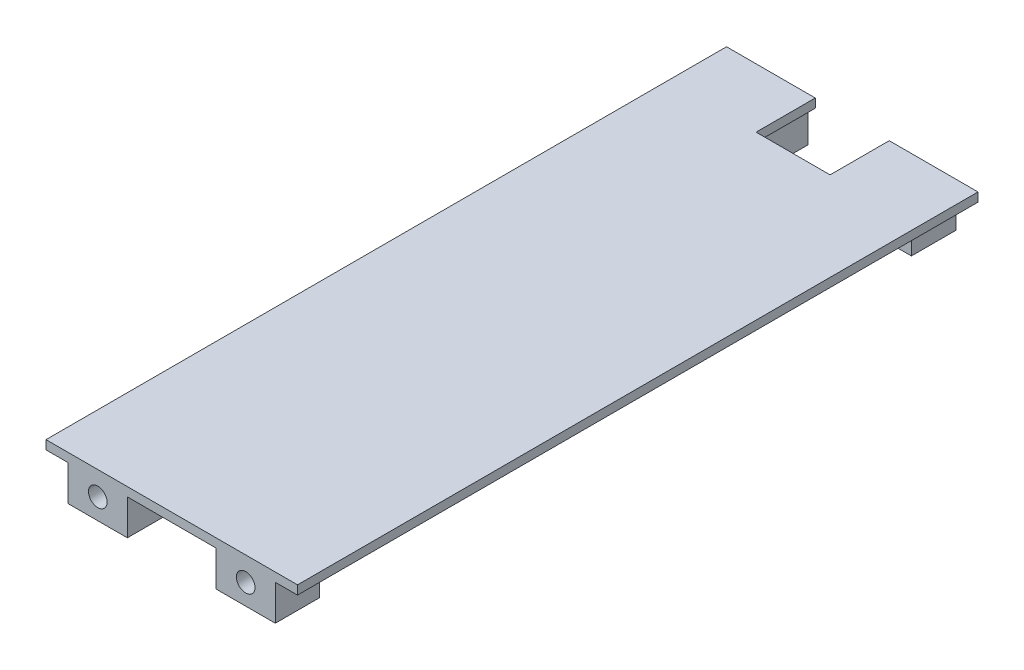
from build123d import *

# Parameters (mm, degrees)
SKETCH1_W           = 20
SKETCH1_H           = 12
SKETCH1_R           = 3.15
SKETCH1_W_2         = 85
SKETCH1_H_2         = 3
BOSS_EXTRUDE1_DEPTH = 230
SKETCH2_W           = 200
SKETCH2_H           = 15
CUT_EXTRUDE1_DEPTH  = 210
SKETCH3_W           = 43.6
SKETCH3_H           = 137.6
SKETCH3_W_2         = 37
SKETCH3_H_2         = 131
BOSS_EXTRUDE2_DEPTH = 12
CUT_EXTRUDE2_DEPTH  = 199.566588327
SKETCH6_R           = 2.5
CUT_EXTRUDE3_DEPTH  = 150
SKETCH7_W           = 25
SKETCH7_H           = 40
CUT_EXTRUDE4_DEPTH  = 150


with BuildPart() as part:
    # Sketch1 → Boss-Extrude1 (new body)
    # profile 1 of 3: a face of its own
    with BuildSketch(Plane.XY):
        with Locations((-25, -1)):
            Rectangle(SKETCH1_W, SKETCH1_H)
        with Locations((-25, 0)):
            Circle(SKETCH1_R, mode=Mode.SUBTRACT)
    # profile 2 of 3: a face of its own
    with BuildSketch(Plane.XY):
        with Locations((25, -1)):
            Rectangle(SKETCH1_W, SKETCH1_H)
        with Locations((25, 0)):
            Circle(SKETCH1_R, mode=Mode.SUBTRACT)
    # profile 3 of 3: a face of its own
    with BuildSketch(Plane.XY):
        with Locations((0, 6.5)):
            Rectangle(SKETCH1_W_2, SKETCH1_H_2)
    extrude(amount=BOSS_EXTRUDE1_DEPTH)

    # Sketch2 → Cut-Extrude1 (cut)
    with BuildSketch(Plane.ZY.offset(35)):
        with Locations((115, -2.5)):
            Rectangle(SKETCH2_W, SKETCH2_H)
    extrude(amount=-CUT_EXTRUDE1_DEPTH, mode=Mode.SUBTRACT)

    # Sketch3 → Boss-Extrude2 (add)
    with BuildSketch(Plane.XZ.offset(-5)):
        with Locations((0, 105)):
            Rectangle(SKETCH3_W, SKETCH3_H)
        with Locations((0, 105)):
            Rectangle(SKETCH3_W_2, SKETCH3_H_2, mode=Mode.SUBTRACT)
    extrude(amount=BOSS_EXTRUDE2_DEPTH)

    # Sketch4 → Cut-Extrude2 (cut, through all)
    with BuildSketch(Plane(origin=(0, 0, 36.2), x_dir=(-1, 0, 0), z_dir=(0, 0, -1))):
        Polygon((0, 0), (-7.5, 0), (-7.5, -8), (7.5, -8), (7.5, 0), align=None)
    extrude(amount=-CUT_EXTRUDE2_DEPTH, mode=Mode.SUBTRACT)

    # Sketch6 → Cut-Extrude3 (cut)
    with BuildSketch(Plane(origin=(0, 0, 36.2), x_dir=(-1, 0, 0), z_dir=(0, 0, -1))):
        with Locations((-12, -4)):
            Circle(SKETCH6_R)
        with Locations((12, -4)):
            Circle(SKETCH6_R)
    extrude(amount=-CUT_EXTRUDE3_DEPTH, mode=Mode.SUBTRACT)

    # Sketch7 → Cut-Extrude4 (cut)
    with BuildSketch(Plane(origin=(0, 8, 0), x_dir=(1, 0, 0), z_dir=(0, 1, 0))):
        Rectangle(SKETCH7_W, SKETCH7_H)
    extrude(amount=-CUT_EXTRUDE4_DEPTH, mode=Mode.SUBTRACT)


solid = part.part
